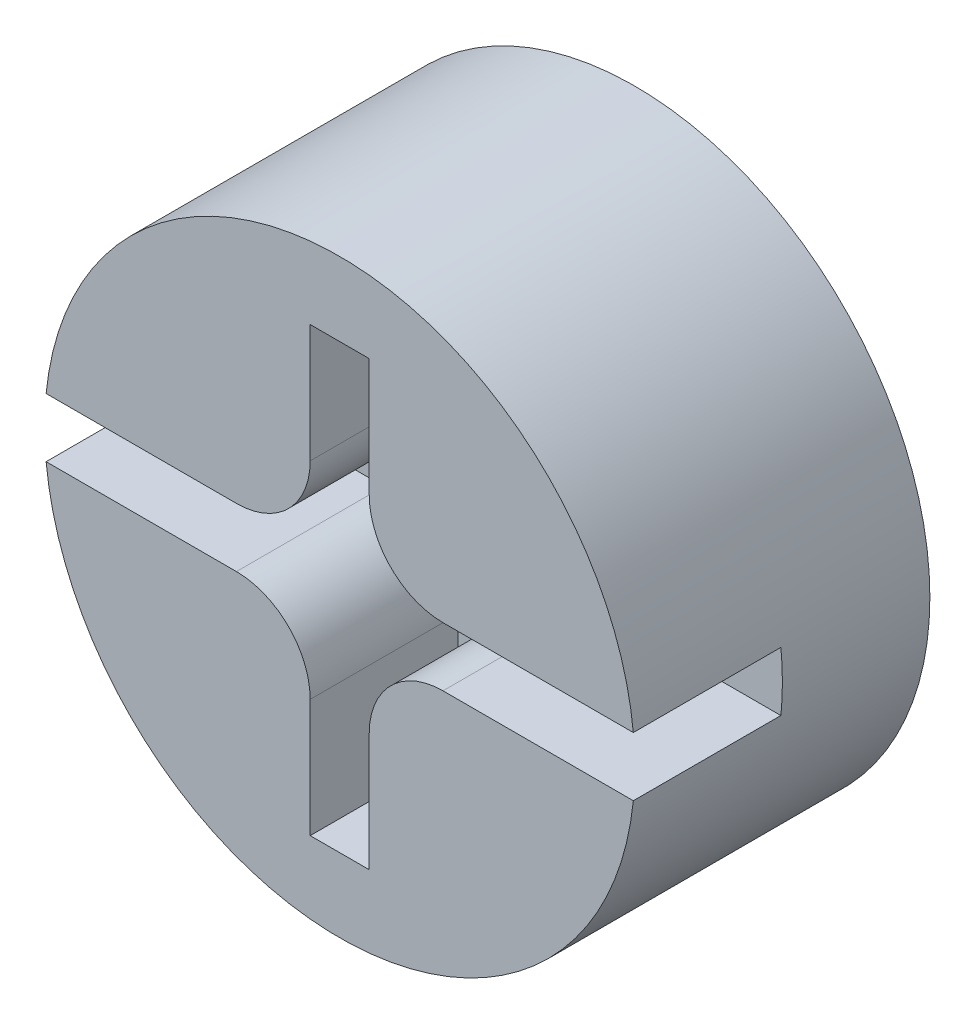
from build123d import *

# Parameters (mm, degrees)
SKETCH_1_W          = 2
SKETCH_1_H          = 2
CUT_EXTRUDE_START   = -1
CUT_EXTRUDE_1_DEPTH = 1
SKETCH_3_W          = 0.4
SKETCH_3_H          = 1
CUT_EXTRUDE_2_DEPTH = 1.3
EXTRUDE_1_DEPTH     = 1
SKETCH_5_W          = 0.4
SKETCH_5_H          = 1.3
CUT_EXTRUDE_3_DEPTH = 1
FILLET_1_R          = 0.5


with BuildPart() as part:
    # Эскиз1 → Повернуть1 (revolve)
    with BuildSketch(Plane(origin=(0, 0, 0), x_dir=(1, 0, 0), z_dir=(0, 1, 0))):
        with Locations((1, -1)):
            Rectangle(SKETCH_1_W, SKETCH_1_H)
    revolve(axis=Axis((0, 0, 0), (0, 0, 1)))

    # Эскиз2 → Вырез-Вытянуть1 (cut)
    with BuildSketch(Plane.XY.offset(2).offset(CUT_EXTRUDE_START)):
        with BuildLine():
            Line((1.989974874, 0.2), (-1.989974874, 0.2))
            ThreePointArc((-1.989974874, 0.2), (0, -2), (1.989974874, 0.2))
        make_face()
    extrude(amount=CUT_EXTRUDE_1_DEPTH, mode=Mode.SUBTRACT)

    # Эскиз3 → Вырез-Вытянуть2 (cut)
    with BuildSketch(Plane.XZ.offset(-0.2)):
        with Locations((0, 1.5)):
            Rectangle(SKETCH_3_W, SKETCH_3_H)
    extrude(amount=-CUT_EXTRUDE_2_DEPTH, mode=Mode.SUBTRACT)

    # Эскиз4 → Бобышка-Вытянуть1 (add)
    with BuildSketch(Plane.XY.offset(1)):
        with BuildLine():
            Line((-1.989974874, -0.2), (1.989974874, -0.2))
            ThreePointArc((1.989974874, -0.2), (0, -2), (-1.989974874, -0.2))
        make_face()
    extrude(amount=EXTRUDE_1_DEPTH)

    # Эскиз5 → Вырез-Вытянуть3 (cut)
    with BuildSketch(Plane.XY.offset(2)):
        with Locations((0, -0.85)):
            Rectangle(SKETCH_5_W, SKETCH_5_H)
    extrude(amount=-CUT_EXTRUDE_3_DEPTH, mode=Mode.SUBTRACT)

    # Скругление1
    fillet_1_edges = [part.edges().sort_by_distance(p)[0] for p in [
        (-0.2, 0.2, 1.5),
        (0.2, 0.2, 1.5),
        (-0.2, -0.2, 1.5),
        (0.2, -0.2, 1.5),
    ]]
    fillet(fillet_1_edges, radius=FILLET_1_R)


solid = part.part
